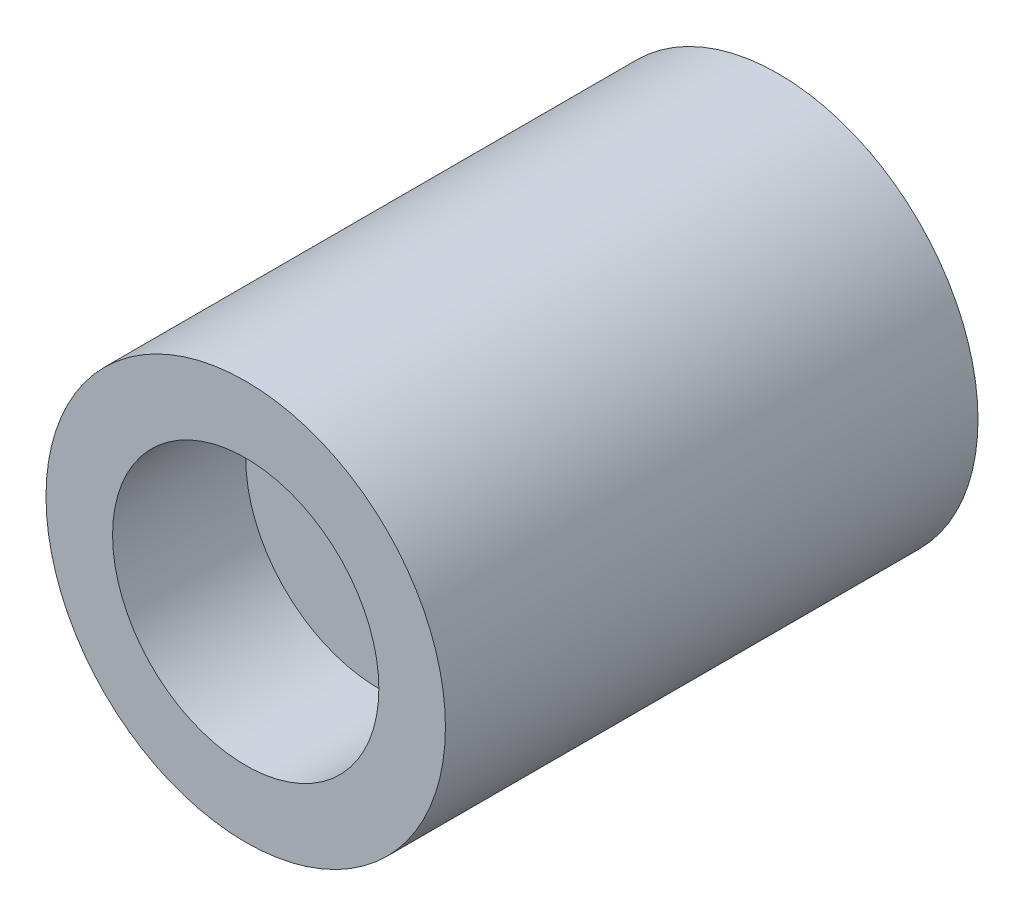
from build123d import *

# Parameters (mm, degrees)
SKETCH1_R           = 3
SKETCH1_R_2         = 2
SKETCH1_R_3         = 1.2
BOSS_EXTRUDE1_DEPTH = 8
CUT_EXTRUDE1_START  = 8
SKETCH1_3_R         = 2
SKETCH1_3_R_2       = 1.2
CUT_EXTRUDE1_DEPTH  = 2
SKETCH1_4_R         = 1.2
CUT_EXTRUDE2_DEPTH  = 5


with BuildPart() as part:
    # Sketch1 → Boss-Extrude1 (new body)
    # profile 1 of 3: a face of its own
    with BuildSketch(Plane(origin=(0, 0, 0), x_dir=(0, 1, 0), z_dir=(0, 0, 1))):
        with Locations(Location((0, 0, 0), (0, 0, 270))):
            Circle(SKETCH1_R)
        Circle(SKETCH1_R_2, mode=Mode.SUBTRACT)
    # profile 2 of 3: a face of its own
    with BuildSketch(Plane(origin=(0, 0, 0), x_dir=(0, 1, 0), z_dir=(0, 0, 1))):
        Circle(SKETCH1_R_2)
        Circle(SKETCH1_R_3, mode=Mode.SUBTRACT)
    # profile 3 of 3: a face of its own
    with BuildSketch(Plane(origin=(0, 0, 0), x_dir=(0, 1, 0), z_dir=(0, 0, 1))):
        Circle(SKETCH1_R_3)
    extrude(amount=BOSS_EXTRUDE1_DEPTH)

    # Sketch1<3> → Cut-Extrude1 (cut)
    # profile 1 of 2: a face of its own
    with BuildSketch(Plane(origin=(0, 0, 0), x_dir=(0, 1, 0), z_dir=(0, 0, 1)).offset(CUT_EXTRUDE1_START)):
        with Locations(Location((0, 0, 0), (0, 0, 270))):
            Circle(SKETCH1_3_R)
        Circle(SKETCH1_3_R_2, mode=Mode.SUBTRACT)
    # profile 2 of 2: a face of its own
    with BuildSketch(Plane(origin=(0, 0, 0), x_dir=(0, 1, 0), z_dir=(0, 0, 1)).offset(CUT_EXTRUDE1_START)):
        Circle(SKETCH1_3_R_2)
    extrude(amount=-CUT_EXTRUDE1_DEPTH, mode=Mode.SUBTRACT)

    # Sketch1<4> → Cut-Extrude2 (cut)
    with BuildSketch(Plane(origin=(0, 0, 0), x_dir=(0, 1, 0), z_dir=(0, 0, 1))):
        with Locations(Location((0, 0, 0), (0, 0, 270))):
            Circle(SKETCH1_4_R)
    extrude(amount=CUT_EXTRUDE2_DEPTH, mode=Mode.SUBTRACT)


solid = part.part
